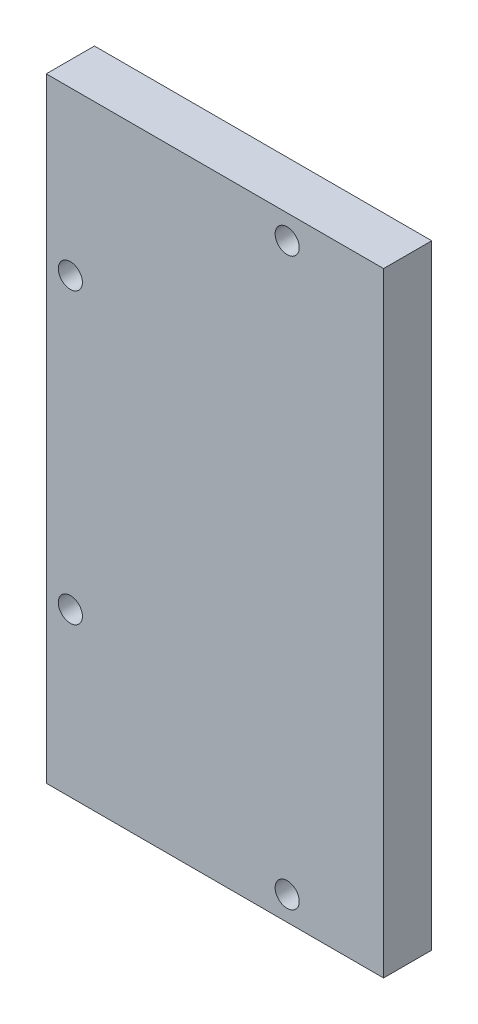
from build123d import *

# Parameters (mm, degrees)
SKETCH1_W           = 88.9
SKETCH1_H           = 161.925
BOSS_EXTRUDE1_DEPTH = 12.7
SKETCH2_R           = 3.175
CUT_EXTRUDE1_DEPTH  = 12.7


with BuildPart() as part:
    # Sketch1 → Boss-Extrude1 (new body)
    with BuildSketch(Plane.XY):
        with Locations((44.45, 20.6375)):
            Rectangle(SKETCH1_W, SKETCH1_H)
    extrude(amount=BOSS_EXTRUDE1_DEPTH)

    # Sketch2 → Cut-Extrude1 (cut)
    with BuildSketch(Plane.XY.offset(12.7)):
        with Locations((63.5, -53.975)):
            Circle(SKETCH2_R)
        with Locations((6.35, -17.4625)):
            Circle(SKETCH2_R)
        with Locations((6.35, 58.7375)):
            Circle(SKETCH2_R)
        with Locations((63.5, 95.25)):
            Circle(SKETCH2_R)
    extrude(amount=-CUT_EXTRUDE1_DEPTH, mode=Mode.SUBTRACT)


solid = part.part
